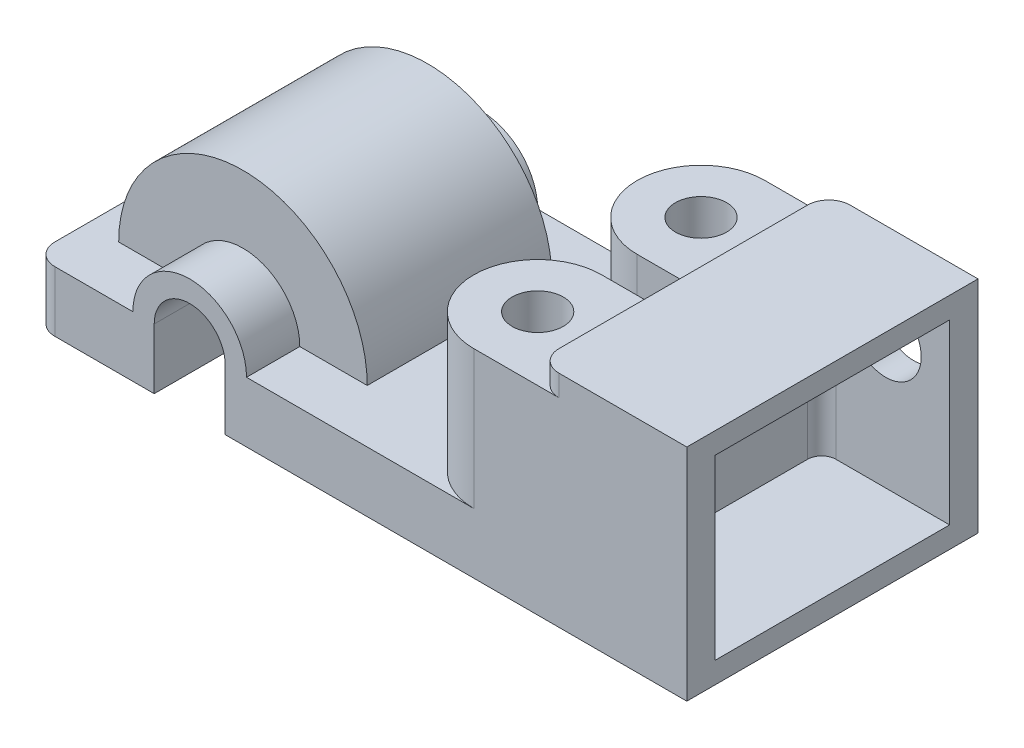
from build123d import *

# Parameters (mm, degrees)
BOSS_EXTRUDE1_DEPTH = 82
SKETCH2_W           = 66
SKETCH2_H           = 50
CUT_EXTRUDE1_DEPTH  = 36
SKETCH3_R           = 10
CUT_EXTRUDE2_DEPTH  = 36
BOSS_EXTRUDE6_DEPTH = 39
SKETCH5_R           = 7.2
CUT_EXTRUDE3_DEPTH  = 27
REVOLVE2_ANGLE      = 180
CUT_EXTRUDE4_DEPTH  = 153
SKETCH10_W          = 54
SKETCH10_H          = 36
CUT_EXTRUDE5_DEPTH  = 17
SKETCH11_W          = 17
SKETCH11_H          = 36
CUT_REVOLVE2_ANGLE  = 180
FILLET1_R           = 4
FILLET2_R           = 6


with BuildPart() as part:
    # Sketch1 → Boss-Extrude1 (new body)
    with BuildSketch(Plane.XY):
        Polygon((-68.304856892, -15.980758971), (115.695143108, -15.980758971), (115.695143108, 46.019241029), (73.695143108, 46.019241029), (73.695143108, 1.019241029), (-68.304856892, 1.019241029), align=None)
    extrude(amount=BOSS_EXTRUDE1_DEPTH)

    # Sketch2 → Cut-Extrude1 (cut)
    with BuildSketch(Plane(origin=(115.695143108, 0, 0), x_dir=(0, 0, -1), z_dir=(1, 0, 0))):
        with Locations((-41, 15.019241029)):
            Rectangle(SKETCH2_W, SKETCH2_H)
    extrude(amount=-CUT_EXTRUDE1_DEPTH, mode=Mode.SUBTRACT)

    # Sketch3 → Cut-Extrude2 (cut)
    with BuildSketch(Plane(origin=(0, 0, 0), x_dir=(-1, 0, 0), z_dir=(0, 0, -1))):
        with Locations((-97.695143108, 27.019241029)):
            Circle(SKETCH3_R)
    extrude(amount=-CUT_EXTRUDE2_DEPTH, mode=Mode.SUBTRACT)

    # Sketch4 → Boss-Extrude6 (add)
    with BuildSketch(Plane(origin=(0, 1.019241029, 0), x_dir=(1, 0, 0), z_dir=(0, 1, 0))):
        with BuildLine():
            Line((55.695143108, -46), (73.695143108, -46))
            Line((73.695143108, -46), (73.695143108, -82))
            Line((73.695143108, -82), (55.695143108, -82))
            ThreePointArc((55.695143108, -82), (37.695143108, -64), (55.695143108, -46))
        make_face()
    boss_extrude6 = extrude(amount=BOSS_EXTRUDE6_DEPTH)

    # Sketch5 → Cut-Extrude3 (cut)
    with BuildSketch(Plane(origin=(0, 40.019241029, 0), x_dir=(1, 0, 0), z_dir=(0, 1, 0))):
        with Locations(Location((55.695143108, -64, 0), (0, 0, 270))):
            Circle(SKETCH5_R)
    cut_extrude3 = extrude(amount=-CUT_EXTRUDE3_DEPTH, mode=Mode.SUBTRACT)

    # Mirror3: Boss-Extrude6, Cut-Extrude3 across plane
    add(boss_extrude6.mirror(Plane.XY.offset(41)))
    add(cut_extrude3.mirror(Plane.XY.offset(41)), mode=Mode.SUBTRACT)

    # Sketch7 → Revolve2 (revolve)
    with BuildSketch(Plane(origin=(0, 1.019241029, 0), x_dir=(1, 0, 0), z_dir=(0, 1, 0))):
        Polygon((-24.304856892, 0), (-24.304856892, -82), (-8.304856892, -82), (-8.304856892, -67), (10.695143108, -67), (10.695143108, -15), (-8.304856892, -15), (-8.304856892, 0), align=None)
    revolve(axis=Axis((-24.304856892, 1.019241029, 0), (0, 0, 1)), revolution_arc=REVOLVE2_ANGLE)

    # Sketch8 → Cut-Extrude4 (cut)
    with BuildSketch(Plane.XY.offset(82)):
        with BuildLine():
            Line((-14.304856892, 1.019241029), (-14.304856892, -15.980758971))
            Line((-14.304856892, -15.980758971), (-34.304856892, -15.980758971))
            Line((-34.304856892, -15.980758971), (-34.304856892, 1.019241029))
            ThreePointArc((-34.304856892, 1.019241029), (-24.304856892, 11.019241029), (-14.304856892, 1.019241029))
        make_face()
    extrude(amount=-CUT_EXTRUDE4_DEPTH, mode=Mode.SUBTRACT)

    # Sketch10 → Cut-Extrude5 (cut)
    with BuildSketch(Plane.XZ.offset(15.980758971)):
        with Locations((-24.304856892, 41)):
            Rectangle(SKETCH10_W, SKETCH10_H)
    extrude(amount=-CUT_EXTRUDE5_DEPTH, mode=Mode.SUBTRACT)

    # Sketch11 → Cut-Revolve2 (revolve, cut)
    with BuildSketch(Plane.XZ.offset(-1.019241029)):
        with Locations((-5.804856892, 41)):
            Rectangle(SKETCH11_W, SKETCH11_H)
    revolve(axis=Axis((-24.304856892, 1.019241029, 0), (0, 0, 1)), revolution_arc=CUT_REVOLVE2_ANGLE, mode=Mode.SUBTRACT)

    # Fillet1
    fillet1_edges = [part.edges().sort_by_distance(p)[0] for p in [
        (79.695143108, 15.019241029, 74),
        (79.695143108, 15.019241029, 8),
    ]]
    fillet(fillet1_edges, radius=FILLET1_R)

    # Fillet2
    fillet2_edges = [part.edges().sort_by_distance(p)[0] for p in [
        (73.695143108, 43.019241029, 82),
        (-68.304856892, -7.480758971, 82),
        (73.695143108, 43.019241029, 0),
        (-68.304856892, -7.480758971, 0),
    ]]
    fillet(fillet2_edges, radius=FILLET2_R)


solid = part.part
